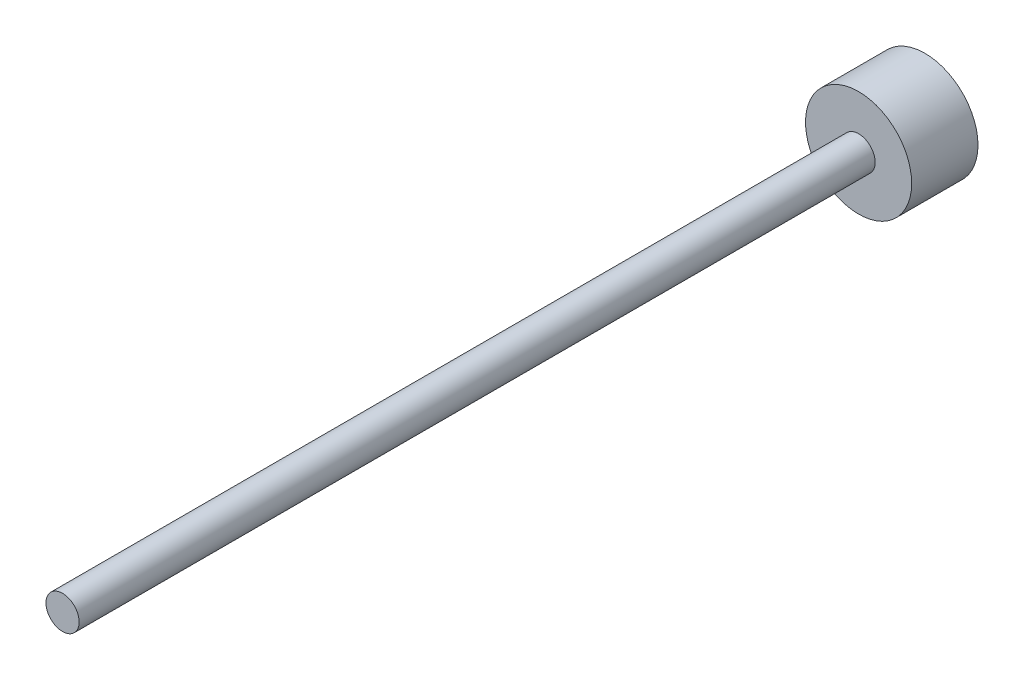
from build123d import *

# Parameters (mm, degrees)
SKETCH_1_R      = 8
EXTRUDE_1_DEPTH = 10
SKETCH_2_R      = 2.5
EXTRUDE_2_DEPTH = 120


with BuildPart() as part:
    # 草图1 → 凸台-拉伸1 (new body)
    with BuildSketch(Plane.XY):
        Circle(SKETCH_1_R)
    extrude(amount=EXTRUDE_1_DEPTH)

    # 草图2 → 凸台-拉伸2 (add)
    with BuildSketch(Plane.XY.offset(10)):
        Circle(SKETCH_2_R)
    extrude(amount=EXTRUDE_2_DEPTH)


solid = part.part
